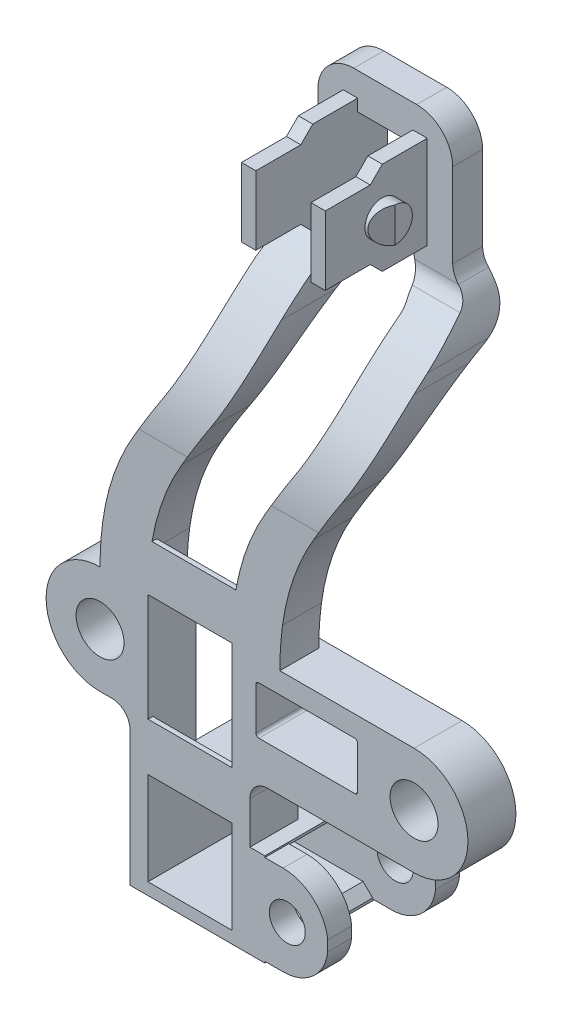
from build123d import *

# Parameters (mm, degrees)
SKETCH1_R               = 4
BOSS_EXTRUDE1_DEPTH     = 22
SKETCH5_W               = 17
SKETCH5_H               = 15.5
SKETCH5_R               = 2.9
CUT_EXTRUDE2_DEPTH      = 4.25
CUT_EXTRUDE3_START      = -4.25
SKETCH4_W               = 17
SKETCH4_H               = 15.5
SKETCH4_R               = 2.9
CUT_EXTRUDE3_DEPTH      = 4.25
CUT_EXTRUDE4_START      = -14
CUT_EXTRUDE4_DEPTH      = 14
CUT_EXTRUDE5_DEPTH      = 17
CUT_EXTRUDE6_REACH      = 134.861
CUT_EXTRUDE7_DEPTH      = 108.338355214
CUT_EXTRUDE7_DEPTH_BACK = 108.338355214
CUT_EXTRUDE8_DEPTH      = 108.338355234
CUT_EXTRUDE8_DEPTH_BACK = 108.338355234
SKETCH13_W              = 14
SKETCH13_H              = 28
SKETCH14_W              = 14
SKETCH14_H              = 11.5
CUT_EXTRUDE9_DEPTH      = 30
SKETCH15_W              = 14
SKETCH15_H              = 13.5
CUT_EXTRUDE10_DEPTH     = 8
CUT_EXTRUDE11_REACH     = 109.338
SKETCH16_R              = 3
CUT_EXTRUDE12_DEPTH     = 10.5
CHAMFER1_SIZE           = 1.6
BOSS_EXTRUDE2_START     = -0.8
SKETCH18_W              = 14
SKETCH18_H              = 8
BOSS_EXTRUDE2_DEPTH     = 0.8


with BuildPart() as part:
    # Sketch1 → Boss-Extrude1 (new body)
    with BuildSketch(Plane.XY):
        with BuildLine():
            Line((38, -34.5), (38, -19))
            Line((38, -19), (25, -19))
            Line((25, -19), (25, -12))
            ThreePointArc((25, -12), (25.878679656, -9.878679656), (28, -9))
            Line((28, -9), (52.4, -9))
            ThreePointArc((52.4, -9), (61.4, 0), (52.4, 9))
            Line((52.4, 9), (30, 9))
            ThreePointArc((30, 9), (30.115319527, 12.416827541), (30.460753267, 15.818104443))
            ThreePointArc((30.460753267, 15.818104443), (32.316314428, 23.574726062), (35.673856371, 30.809033096))
            Line((35.673856371, 30.809033096), (39.91833493, 37.980857506))
            ThreePointArc((39.91833493, 37.980857506), (43.248557877, 45.136867067), (45.108783256, 52.807487592))
            ThreePointArc((45.108783256, 52.807487592), (45.253889742, 53.93570221), (45.373727983, 55.066879875))
            ThreePointArc((45.373727983, 55.066879875), (44.906430441, 59.167258887), (42.823150368, 62.729760701))
            ThreePointArc((42.823150368, 62.729760701), (42.101737137, 63.899201369), (41.85, 65.25))
            Line((41.85, 65.25), (41.85, 79.25))
            ThreePointArc((41.85, 79.25), (40.092640687, 83.492640687), (35.85, 85.25))
            Line((35.85, 85.25), (25.35, 85.25))
            ThreePointArc((25.35, 85.25), (21.107359313, 83.492640687), (19.35, 79.25))
            Line((19.35, 79.25), (19.35, 65.25))
            ThreePointArc((19.35, 65.25), (19.074301979, 63.838714856), (18.287746263, 62.63494359))
            ThreePointArc((18.287746263, 62.63494359), (16.325644894, 59.742342577), (15.47888374, 56.351180837))
            ThreePointArc((15.47888374, 56.351180837), (15.324875029, 54.576092262), (15.108783256, 52.807487592))
            ThreePointArc((15.108783256, 52.807487592), (13.248557877, 45.136867067), (9.91833493, 37.980857506))
            Line((9.91833493, 37.980857506), (5.673856371, 30.809033096))
            ThreePointArc((5.673856371, 30.809033096), (2.316314428, 23.574726062), (0.460753267, 15.818104443))
            ThreePointArc((0.460753267, 15.818104443), (0.115319527, 12.416827541), (0, 9))
            ThreePointArc((0, 9), (-9, 0), (0, -9))
            Line((0, -9), (2, -9))
            ThreePointArc((2, -9), (4.121320344, -9.878679656), (5, -12))
            Line((5, -12), (5, -34.5))
            Line((5, -34.5), (38, -34.5))
        make_face()
        Circle(SKETCH1_R, mode=Mode.SUBTRACT)
        with Locations((52.4, 0)):
            Circle(SKETCH1_R, mode=Mode.SUBTRACT)
        with BuildLine():
            Line((42.5, -2.5), (26.5, -2.5))
            ThreePointArc((26.5, -2.5), (26.146446609, -2.353553391), (26, -2))
            Line((26, -2), (26, 5))
            ThreePointArc((26, 5), (26.146446609, 5.353553391), (26.5, 5.5))
            Line((26.5, 5.5), (42.5, 5.5))
            ThreePointArc((42.5, 5.5), (42.853553391, 5.353553391), (43, 5))
            Line((43, 5), (43, -2))
            ThreePointArc((43, -2), (42.853553391, -2.353553391), (42.5, -2.5))
        make_face(mode=Mode.SUBTRACT)
        with BuildLine():
            Line((31.91833493, 37.798447967), (27.673856371, 30.626623557))
            ThreePointArc((27.673856371, 30.626623557), (24.316314428, 23.392316523), (22.460753267, 15.635694904))
            ThreePointArc((22.460753267, 15.635694904), (22.115319527, 12.234418002), (22, 8.817590461))
            Line((22, 8.817590461), (22, -19))
            Line((22, -19), (8, -19))
            Line((8, -19), (8, 8.817590461))
            ThreePointArc((8, 8.817590461), (8.115319527, 12.234418002), (8.460753267, 15.635694904))
            ThreePointArc((8.460753267, 15.635694904), (10.316314428, 23.392316523), (13.673856371, 30.626623557))
            Line((13.673856371, 30.626623557), (17.91833493, 37.798447967))
            ThreePointArc((17.91833493, 37.798447967), (21.248557877, 44.954457528), (23.108783256, 52.625078053))
            ThreePointArc((23.108783256, 52.625078053), (23.409488459, 55.278652202), (23.570490575, 57.944352429))
            ThreePointArc((23.570490575, 57.944352429), (23.680808223, 58.534627624), (23.961373661, 59.065549297))
            ThreePointArc((23.961373661, 59.065549297), (25.477203199, 61.994104277), (26, 65.25))
            Line((26, 65.25), (26, 79.25))
            Line((26, 79.25), (35.2, 79.25))
            Line((35.2, 79.25), (35.2, 65.25))
            ThreePointArc((35.2, 65.25), (35.709369035, 62.035125336), (37.187580597, 59.135165596))
            ThreePointArc((37.187580597, 59.135165596), (37.482425492, 58.543952017), (37.568571738, 57.888936115))
            ThreePointArc((37.568571738, 57.888936115), (37.407083465, 55.251031947), (37.108783256, 52.625078053))
            ThreePointArc((37.108783256, 52.625078053), (35.248557877, 44.954457528), (31.91833493, 37.798447967))
        make_face(mode=Mode.SUBTRACT)
    extrude(amount=BOSS_EXTRUDE1_DEPTH)

    # Sketch5 → Cut-Extrude2 (cut)
    with BuildSketch(Plane.ZY.offset(-19.35)):
        with Locations((13.5, 73.5)):
            Rectangle(SKETCH5_W, SKETCH5_H)
        with Locations(Location((12.5, 73.5, 0), (0, 0, 180))):
            Circle(SKETCH5_R, mode=Mode.SUBTRACT)
    extrude(amount=-CUT_EXTRUDE2_DEPTH, mode=Mode.SUBTRACT)

    # Sketch4 → Cut-Extrude3 (cut)
    with BuildSketch(Plane(origin=(41.85, 0, 0), x_dir=(0, 0, -1), z_dir=(1, 0, 0)).offset(CUT_EXTRUDE3_START)):
        with Locations((-13.5, 73.5)):
            Rectangle(SKETCH4_W, SKETCH4_H)
        with Locations((-12.5, 73.5)):
            Circle(SKETCH4_R, mode=Mode.SUBTRACT)
    extrude(amount=CUT_EXTRUDE3_DEPTH, mode=Mode.SUBTRACT)

    # Sketch6 → Cut-Extrude4 (cut)
    with BuildSketch(Plane.ZY.offset(-23.6).offset(CUT_EXTRUDE4_START)):
        Polygon((12.5, 81.25), (14.5, 79.25), (22, 79.25), (22, 81.25), align=None)
        Polygon((12.5, 65.75), (14.5, 67.75), (22, 67.75), (22, 65.75), align=None)
    extrude(amount=CUT_EXTRUDE4_DEPTH, mode=Mode.SUBTRACT)

    # Sketch7 → Cut-Extrude5 (cut)
    with BuildSketch(Plane.XY.offset(22)):
        Polygon((19.35, 65.75), (19.35, 65.25), (41.85, 65.25), (41.85, 65.75), (35.2, 65.75), (35.2, 81.25), (41.85, 81.25), (41.85, 85.25), (19.35, 85.25), (19.35, 81.25), (26, 81.25), (26, 65.75), align=None)
    extrude(amount=-CUT_EXTRUDE5_DEPTH, mode=Mode.SUBTRACT)

    # Cut-Extrude6: up to this face of the body (flat: up to its plane)
    cut_extrude6_end = Plane(part.part.faces().sort_by_distance((36.4, 65.75, 8.75))[0])
    # Sketch8 → Cut-Extrude6 (cut, up to the picked face)
    with BuildSketch(Plane(origin=(0, 81.25, 0), x_dir=(1, 0, 0), z_dir=(0, 1, 0)), mode=Mode.PRIVATE) as cut_extrude6_sk1:
        Polygon((21.5, -12.5), (23.1, -15.4), (19.35, -15.4), (19.35, -9.6), (21.475, -9.6), align=None)
    cut_extrude6_tool1 = split(extrude(cut_extrude6_sk1.sketch, amount=-CUT_EXTRUDE6_REACH, mode=Mode.PRIVATE), bisect_by=cut_extrude6_end, keep=Keep.BOTH, mode=Mode.PRIVATE)
    # Sketch8 → Cut-Extrude6 (cut, up to the picked face)
    with BuildSketch(Plane(origin=(0, 81.25, 0), x_dir=(1, 0, 0), z_dir=(0, 1, 0)), mode=Mode.PRIVATE) as cut_extrude6_sk2:
        Polygon((39.7, -12.5), (38.1, -15.4), (41.85, -15.4), (41.85, -9.6), (39.725, -9.6), align=None)
    cut_extrude6_tool2 = split(extrude(cut_extrude6_sk2.sketch, amount=-CUT_EXTRUDE6_REACH, mode=Mode.PRIVATE), bisect_by=cut_extrude6_end, keep=Keep.BOTH, mode=Mode.PRIVATE)
    add(cut_extrude6_tool1.solids().sort_by(Axis((20.675287, 81.25, 12.808763), (0, -1, 0)))[0], mode=Mode.SUBTRACT)
    add(cut_extrude6_tool2.solids().sort_by(Axis((40.524713, 81.25, 12.808763), (0, -1, 0)))[0], mode=Mode.SUBTRACT)

    # Sketch12 → Cut-Extrude7 (cut, two sides: drawn at the far end of the back side and taken through both)
    with BuildSketch(Plane(origin=(0, 0, 0), x_dir=(0, 0, -1), z_dir=(1, 0, 0)).offset(-CUT_EXTRUDE7_DEPTH_BACK)):
        with BuildLine():
            Line((-22, 65.25), (-5, 65.25))
            Line((-5, 65.25), (-5, 62.739584346))
            ThreePointArc((-5, 62.739584346), (-5.37797788, 61.281846372), (-6.416666667, 60.19143687))
            ThreePointArc((-6.416666667, 60.19143687), (-17.842243325, 48.196932353), (-22, 32.161814643))
            Line((-22, 32.161814643), (-22, 65.25))
        make_face()
        with BuildLine():
            Line((-15.5, 9), (0, 9))
            Line((0, 9), (0, 60.958515843))
            ThreePointArc((0, 60.958515843), (-0.955627182, 57.166839222), (-3.594202899, 54.281019912))
            ThreePointArc((-3.594202899, 54.281019912), (-12.334484961, 44.721743448), (-15.5, 32.161814643))
            Line((-15.5, 32.161814643), (-15.5, 9))
        make_face()
    extrude(amount=CUT_EXTRUDE7_DEPTH + CUT_EXTRUDE7_DEPTH_BACK, mode=Mode.SUBTRACT)

    # Sketch13 → Cut-Extrude8 (cut, two sides: drawn at the far end of the back side and taken through both)
    with BuildSketch(Plane(origin=(0, 0, 0), x_dir=(0, 0, -1), z_dir=(1, 0, 0)).offset(-CUT_EXTRUDE8_DEPTH_BACK)):
        with Locations((-7, -5)):
            Rectangle(SKETCH13_W, SKETCH13_H)
    extrude(amount=CUT_EXTRUDE8_DEPTH + CUT_EXTRUDE8_DEPTH_BACK, mode=Mode.SUBTRACT)

    # Sketch14 → Cut-Extrude9 (cut)
    with BuildSketch(Plane(origin=(38, 0, 0), x_dir=(0, 0, -1), z_dir=(1, 0, 0))):
        with Locations((-11, -26.75)):
            Rectangle(SKETCH14_W, SKETCH14_H)
    extrude(amount=-CUT_EXTRUDE9_DEPTH, mode=Mode.SUBTRACT)

    # Sketch15 → Cut-Extrude10 (cut)
    with BuildSketch(Plane.XY.offset(22)):
        with Locations((15, -25.75)):
            Rectangle(SKETCH15_W, SKETCH15_H)
    extrude(amount=-CUT_EXTRUDE10_DEPTH, mode=Mode.SUBTRACT)

    # Cut-Extrude11: up to this face of the body (flat: up to its plane)
    cut_extrude11_end = Plane(part.part.faces().sort_by_distance((36.4, 73.5, 22))[0])
    # Sketch16 → Cut-Extrude11 (cut, up to the picked face)
    with BuildSketch(Plane(origin=(0, 0, 0), x_dir=(-1, 0, 0), z_dir=(0, 0, -1)), mode=Mode.PRIVATE) as cut_extrude11_sk1:
        with Locations((-31.25, -26.75)):
            Circle(SKETCH16_R)
    cut_extrude11_tool1 = split(extrude(cut_extrude11_sk1.sketch, amount=-CUT_EXTRUDE11_REACH, mode=Mode.PRIVATE), bisect_by=cut_extrude11_end, keep=Keep.BOTH, mode=Mode.PRIVATE)
    # Sketch16 → Cut-Extrude11 (cut, up to the picked face)
    with BuildSketch(Plane(origin=(0, 0, 0), x_dir=(-1, 0, 0), z_dir=(0, 0, -1)), mode=Mode.PRIVATE) as cut_extrude11_sk2:
        with BuildLine():
            Line((-30.55, -19.25), (-38, -19.25))
            Line((-38, -19.25), (-38, -25.885419177))
            ThreePointArc((-38, -25.885419177), (-35.538268428, -21.149359136), (-30.55, -19.25))
        make_face()
    cut_extrude11_tool2 = split(extrude(cut_extrude11_sk2.sketch, amount=-CUT_EXTRUDE11_REACH, mode=Mode.PRIVATE), bisect_by=cut_extrude11_end, keep=Keep.BOTH, mode=Mode.PRIVATE)
    # Sketch16 → Cut-Extrude11 (cut, up to the picked face)
    with BuildSketch(Plane(origin=(0, 0, 0), x_dir=(-1, 0, 0), z_dir=(0, 0, -1)), mode=Mode.PRIVATE) as cut_extrude11_sk3:
        with BuildLine():
            Line((-30.55, -34.25), (-38, -34.25))
            Line((-38, -34.25), (-38, -27.614580823))
            ThreePointArc((-38, -27.614580823), (-35.538268428, -32.350640864), (-30.55, -34.25))
        make_face()
    cut_extrude11_tool3 = split(extrude(cut_extrude11_sk3.sketch, amount=-CUT_EXTRUDE11_REACH, mode=Mode.PRIVATE), bisect_by=cut_extrude11_end, keep=Keep.BOTH, mode=Mode.PRIVATE)
    add(cut_extrude11_tool1.solids().sort_by(Axis((31.25, -26.75, 0), (0, 0, 1)))[0], mode=Mode.SUBTRACT)
    add(cut_extrude11_tool2.solids().sort_by(Axis((36.326008, -20.872433, 0), (0, 0, 1)))[0], mode=Mode.SUBTRACT)
    add(cut_extrude11_tool3.solids().sort_by(Axis((36.326008, -32.627567, 0), (0, 0, 1)))[0], mode=Mode.SUBTRACT)

    # Sketch17 → Cut-Extrude12 (cut)
    with BuildSketch(Plane(origin=(38, 0, 0), x_dir=(0, 0, -1), z_dir=(1, 0, 0))):
        Polygon((-18, -34.25), (-18, -19.25), (-22, -19.25), (-22, -19), (0, -19), (0, -19.25), (-4, -19.25), (-4, -34.25), (0, -34.25), (0, -34.5), (-22, -34.5), (-22, -34.25), align=None)
    extrude(amount=-CUT_EXTRUDE12_DEPTH, mode=Mode.SUBTRACT)

    # Chamfer1
    chamfer1_edges = [part.edges().sort_by_distance(p)[0] for p in [
        (27.5, -32.5, 11),
        (27.5, -21, 11),
    ]]
    chamfer(chamfer1_edges, length=CHAMFER1_SIZE)

    # Sketch18 → Boss-Extrude2 (add)
    with BuildSketch(Plane.XY.offset(22).offset(BOSS_EXTRUDE2_START)):
        with Locations((15, -13)):
            Rectangle(SKETCH18_W, SKETCH18_H)
        with BuildLine():
            Line((8.000328291, 9), (22.000328291, 9))
            ThreePointArc((22.000328291, 9), (22.121550825, 12.32540984), (22.460753267, 15.635694904))
            ThreePointArc((22.460753267, 15.635694904), (22.559504283, 16.318750177), (22.670025542, 17))
            Line((22.670025542, 17), (8.670025542, 17))
            ThreePointArc((8.670025542, 17), (8.559504283, 16.318750177), (8.460753267, 15.635694904))
            ThreePointArc((8.460753267, 15.635694904), (8.121550825, 12.32540984), (8.000328291, 9))
        make_face()
    extrude(amount=BOSS_EXTRUDE2_DEPTH)


solid = part.part
